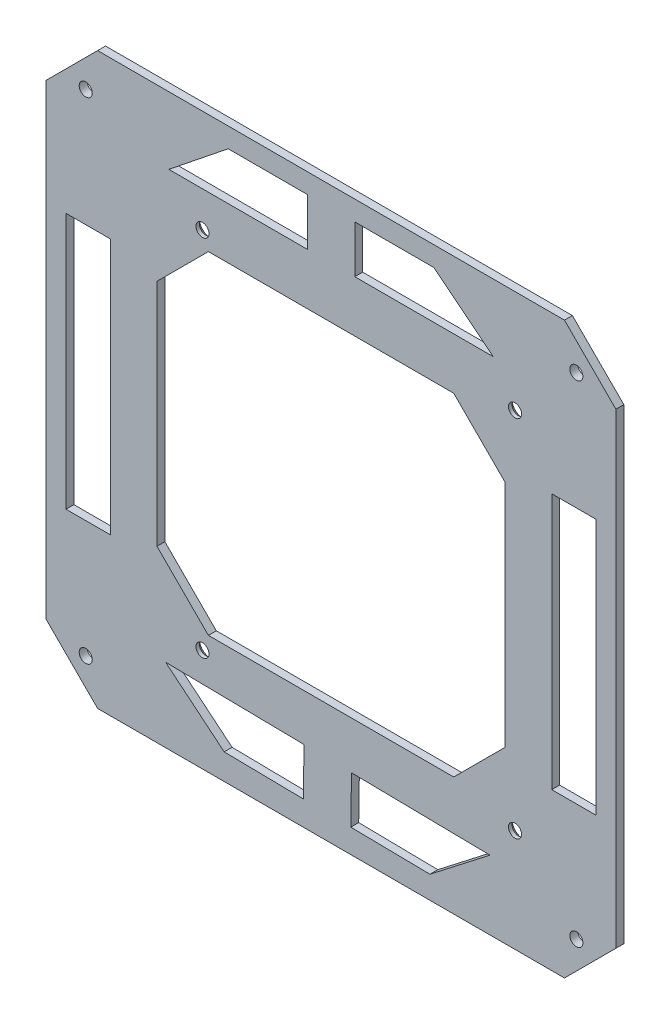
from build123d import *

# Parameters (mm, degrees)
SKETCH_1_W                     = 144
SKETCH_1_H                     = 144
SKETCH_1_R                     = 1.65
SKETCH_1_W_2                   = 11.212967435
SKETCH_1_H_2                   = 64.771297792
SKETCH_1_W_3                   = 88
SKETCH_1_H_3                   = 84
EXTRUDE_79X92_DEPTH            = 2
SKETCH_2_R                     = 2.75
M3_D5P5_1P1_90_DEPTH           = 1.1
M3_D5P5_1P1_90_DRAFT           = 45
M3_D5P5_1P1_90_PROFILE_2_DEPTH = 1.1
M3_D5P5_1P1_90_PROFILE_2_DRAFT = 45
M3_D5P5_1P1_90_PROFILE_3_DEPTH = 1.1
M3_D5P5_1P1_90_PROFILE_3_DRAFT = 45
M3_D5P5_1P1_90_PROFILE_4_DEPTH = 1.1
M3_D5P5_1P1_90_PROFILE_4_DRAFT = 45
CHAMFER_1_SIZE                 = 13


with BuildPart() as part:
    # 草图1 → 几何镂空托板_原装79x92孔距 (new body)
    with BuildSketch(Plane.XY):
        Rectangle(SKETCH_1_W, SKETCH_1_H)
        with Locations((-62, -62)):
            Circle(SKETCH_1_R, mode=Mode.SUBTRACT)
        with Locations((-62, 62)):
            Circle(SKETCH_1_R, mode=Mode.SUBTRACT)
        with Locations((62, -62)):
            Circle(SKETCH_1_R, mode=Mode.SUBTRACT)
        with Locations((62, 62)):
            Circle(SKETCH_1_R, mode=Mode.SUBTRACT)
        with Locations((-32.5, -46)):
            Circle(SKETCH_1_R, mode=Mode.SUBTRACT)
        with Locations((-32.5, 46)):
            Circle(SKETCH_1_R, mode=Mode.SUBTRACT)
        with Locations((46.5, -46)):
            Circle(SKETCH_1_R, mode=Mode.SUBTRACT)
        with Locations((46.5, 46)):
            Circle(SKETCH_1_R, mode=Mode.SUBTRACT)
        Polygon((-26, 67), (-6, 67), (-6, 55), (-41, 55), align=None, mode=Mode.SUBTRACT)
        Polygon((4.990317383, -65.990169234), (5.172518716, -53.991552536), (40.168484086, -54.52297309), (24.98801188, -66.293838123), align=None, mode=Mode.SUBTRACT)
        Polygon((-7.008299316, -65.807967901), (-6.826097982, -53.809351203), (-41.822063353, -53.277930648), (-27.005993813, -65.504299013), align=None, mode=Mode.SUBTRACT)
        with Locations((61.393516283, 0)):
            Rectangle(SKETCH_1_W_2, SKETCH_1_H_2, mode=Mode.SUBTRACT)
        with Locations((-61.393516283, 0)):
            Rectangle(SKETCH_1_W_2, SKETCH_1_H_2, mode=Mode.SUBTRACT)
        Rectangle(SKETCH_1_W_3, SKETCH_1_H_3, mode=Mode.SUBTRACT)
        Polygon((6, 55), (41, 55), (26, 67), (6, 67), align=None, mode=Mode.SUBTRACT)
    extrude(amount=EXTRUDE_79X92_DEPTH)


with BuildPart() as m3_d5p5_1p1_90_tool:
    # 草图2 → M3沉头四孔_D5p5_深1p1_90度 (with draft: the straight prism first)
    with BuildSketch(Plane.XY):
        with Locations((-32.5, -46)):
            Circle(SKETCH_2_R)
    extrude(amount=M3_D5P5_1P1_90_DEPTH)
    # M3沉头四孔_D5p5_深1p1_90度: the draft: its side faces are tilted about the plane it starts from
    m3_d5p5_1p1_90_sides = [m3_d5p5_1p1_90_tool.faces().sort_by_distance(p)[0] for p in [
        (-35.25, -46, 0.55),
    ]]
    draft(m3_d5p5_1p1_90_sides, Plane.XY, M3_D5P5_1P1_90_DRAFT)


with BuildPart() as part_1:
    add(part.part)

    # M3沉头四孔_D5p5_深1p1_90度: cut by m3_d5p5_1p1_90_tool
    add(m3_d5p5_1p1_90_tool.part, mode=Mode.SUBTRACT)


with BuildPart() as m3_d5p5_1p1_90_profile_2_tool:
    # 草图2 → M3沉头四孔_D5p5_深1p1_90度 profile 2 (with draft: the straight prism first)
    with BuildSketch(Plane.XY):
        with Locations((-32.5, 46)):
            Circle(SKETCH_2_R)
    extrude(amount=M3_D5P5_1P1_90_PROFILE_2_DEPTH)
    # M3沉头四孔_D5p5_深1p1_90度 profile 2: the draft: its side faces are tilted about the plane it starts from
    m3_d5p5_1p1_90_profile_2_sides = [m3_d5p5_1p1_90_profile_2_tool.faces().sort_by_distance(p)[0] for p in [
        (-35.25, 46, 0.55),
    ]]
    draft(m3_d5p5_1p1_90_profile_2_sides, Plane.XY, M3_D5P5_1P1_90_PROFILE_2_DRAFT)


with BuildPart() as part_2:
    add(part_1.part)

    # M3沉头四孔_D5p5_深1p1_90度 profile 2: cut by m3_d5p5_1p1_90_profile_2_tool
    add(m3_d5p5_1p1_90_profile_2_tool.part, mode=Mode.SUBTRACT)


with BuildPart() as m3_d5p5_1p1_90_profile_3_tool:
    # 草图2 → M3沉头四孔_D5p5_深1p1_90度 profile 3 (with draft: the straight prism first)
    with BuildSketch(Plane.XY):
        with Locations((46.5, -46)):
            Circle(SKETCH_2_R)
    extrude(amount=M3_D5P5_1P1_90_PROFILE_3_DEPTH)
    # M3沉头四孔_D5p5_深1p1_90度 profile 3: the draft: its side faces are tilted about the plane it starts from
    m3_d5p5_1p1_90_profile_3_sides = [m3_d5p5_1p1_90_profile_3_tool.faces().sort_by_distance(p)[0] for p in [
        (43.75, -46, 0.55),
    ]]
    draft(m3_d5p5_1p1_90_profile_3_sides, Plane.XY, M3_D5P5_1P1_90_PROFILE_3_DRAFT)


with BuildPart() as part_3:
    add(part_2.part)

    # M3沉头四孔_D5p5_深1p1_90度 profile 3: cut by m3_d5p5_1p1_90_profile_3_tool
    add(m3_d5p5_1p1_90_profile_3_tool.part, mode=Mode.SUBTRACT)


with BuildPart() as m3_d5p5_1p1_90_profile_4_tool:
    # 草图2 → M3沉头四孔_D5p5_深1p1_90度 profile 4 (with draft: the straight prism first)
    with BuildSketch(Plane.XY):
        with Locations((46.5, 46)):
            Circle(SKETCH_2_R)
    extrude(amount=M3_D5P5_1P1_90_PROFILE_4_DEPTH)
    # M3沉头四孔_D5p5_深1p1_90度 profile 4: the draft: its side faces are tilted about the plane it starts from
    m3_d5p5_1p1_90_profile_4_sides = [m3_d5p5_1p1_90_profile_4_tool.faces().sort_by_distance(p)[0] for p in [
        (43.75, 46, 0.55),
    ]]
    draft(m3_d5p5_1p1_90_profile_4_sides, Plane.XY, M3_D5P5_1P1_90_PROFILE_4_DRAFT)


with BuildPart() as part_4:
    add(part_3.part)

    # M3沉头四孔_D5p5_深1p1_90度 profile 4: cut by m3_d5p5_1p1_90_profile_4_tool
    add(m3_d5p5_1p1_90_profile_4_tool.part, mode=Mode.SUBTRACT)

    # 倒角1
    chamfer_1_edges = [part_4.edges().sort_by_distance(p)[0] for p in [
        (-72, 72, 1),
        (72, 72, 1),
        (-44, 42, 1),
        (72, -72, 1),
        (-44, -42, 1),
        (44, -42, 1),
        (44, 42, 1),
        (-72, -72, 1),
    ]]
    chamfer(chamfer_1_edges, length=CHAMFER_1_SIZE)


solid = part_4.part
